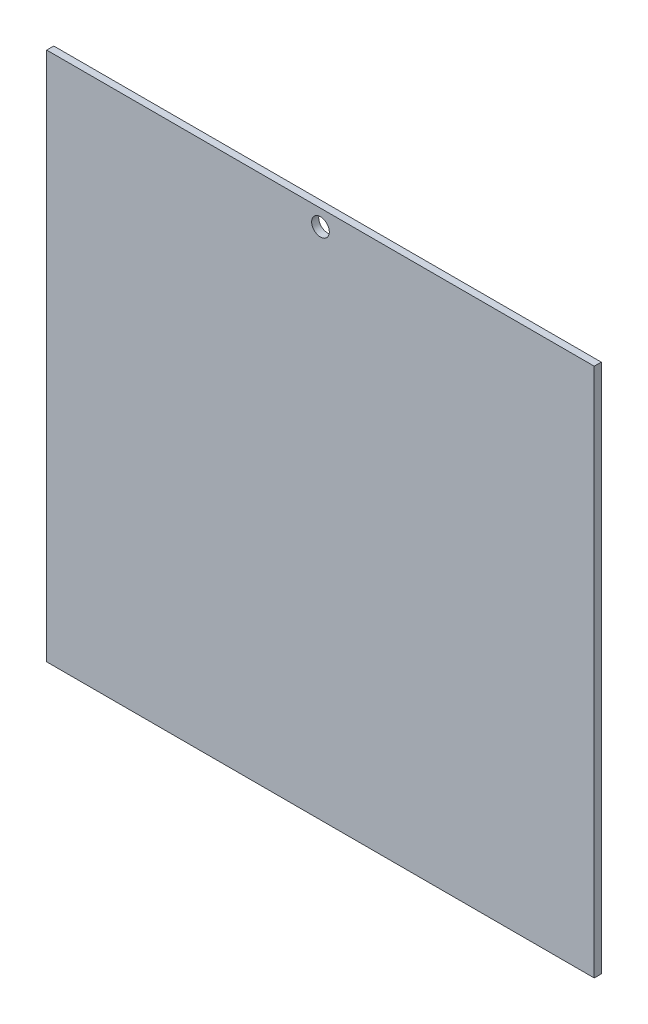
from build123d import *

# Parameters (mm, degrees)
SKETCH1_W           = 310
SKETCH1_H           = 300
BOSS_EXTRUDE1_DEPTH = 4
SKETCH2_R           = 5
CUT_EXTRUDE1_DEPTH  = 10


with BuildPart() as part:
    # Sketch1 → Boss-Extrude1 (new body)
    with BuildSketch(Plane.XY):
        Rectangle(SKETCH1_W, SKETCH1_H)
    extrude(amount=BOSS_EXTRUDE1_DEPTH)

    # Sketch2 → Cut-Extrude1 (cut)
    with BuildSketch(Plane.XY.offset(4)):
        with Locations((0, 140.812034156)):
            Circle(SKETCH2_R)
    extrude(amount=-CUT_EXTRUDE1_DEPTH, mode=Mode.SUBTRACT)


solid = part.part
